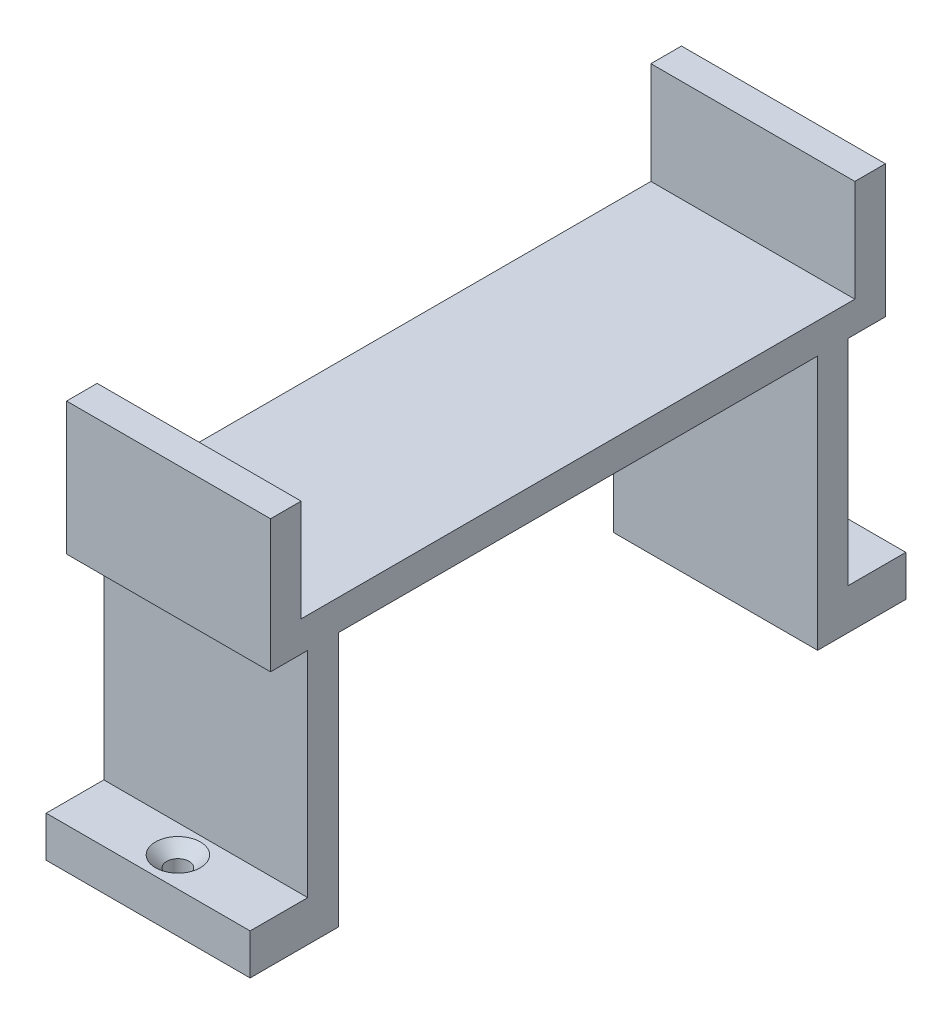
from build123d import *

# Parameters (mm, degrees)
SKETCH1_W                                           = 60.3
SKETCH1_H                                           = 38
BOSS_EXTRUDE1_DEPTH                                 = 10
SKETCH3_W                                           = 20
SKETCH3_H                                           = 54.3
CUT_EXTRUDE1_DEPTH                                  = 10
SKETCH4_W                                           = 20
SKETCH4_H                                           = 47
CUT_EXTRUDE2_DEPTH                                  = 25
SKETCH6_W                                           = 10
SKETCH6_H                                           = 21
CUT_EXTRUDE3_DEPTH                                  = 3.65
SKETCH7_W                                           = 10
SKETCH7_H                                           = 21
CUT_EXTRUDE4_DEPTH                                  = 3.65
MOVE_FACE1_BY                                       = 2
MOVE_FACE1_2_BY                                     = 2
MOVE_FACE2_BY                                       = 10
CSK_FOR_M2_COUNTERSUNK_FLAT_HEAD_SCREW2_D           = 2.2
CSK_FOR_M2_COUNTERSUNK_FLAT_HEAD_SCREW2_DEPTH       = 4
CSK_FOR_M2_COUNTERSUNK_FLAT_HEAD_SCREW2_CSINK_D     = 4.4
CSK_FOR_M2_COUNTERSUNK_FLAT_HEAD_SCREW2_CSINK_ANGLE = 90


with BuildPart() as part:
    # Sketch1 → Boss-Extrude1 (new body)
    with BuildSketch(Plane(origin=(0, 0, 0), x_dir=(0, 0, -1), z_dir=(1, 0, 0))):
        Rectangle(SKETCH1_W, SKETCH1_H)
    extrude(amount=BOSS_EXTRUDE1_DEPTH)

    # Sketch3 → Cut-Extrude1 (cut)
    with BuildSketch(Plane(origin=(0, 19, 0), x_dir=(1, 0, 0), z_dir=(0, 1, 0))):
        Rectangle(SKETCH3_W, SKETCH3_H)
    extrude(amount=-CUT_EXTRUDE1_DEPTH, mode=Mode.SUBTRACT)

    # Sketch4 → Cut-Extrude2 (cut)
    with BuildSketch(Plane.XZ.offset(19)):
        Rectangle(SKETCH4_W, SKETCH4_H)
    extrude(amount=-CUT_EXTRUDE2_DEPTH, mode=Mode.SUBTRACT)

    # Sketch6 → Cut-Extrude3 (cut)
    with BuildSketch(Plane(origin=(0, 0, -30.15), x_dir=(-1, 0, 0), z_dir=(0, 0, -1))):
        with Locations((-5, -4.5)):
            Rectangle(SKETCH6_W, SKETCH6_H)
    extrude(amount=-CUT_EXTRUDE3_DEPTH, mode=Mode.SUBTRACT)

    # Sketch7 → Cut-Extrude4 (cut)
    with BuildSketch(Plane.XY.offset(30.15)):
        with Locations((5, -4.5)):
            Rectangle(SKETCH7_W, SKETCH7_H)
    extrude(amount=-CUT_EXTRUDE4_DEPTH, mode=Mode.SUBTRACT)

    # Move Face1: a face moved outward by 2.0
    extrude(part.faces().sort_by_distance((5, -17, 30.15))[0], amount=MOVE_FACE1_BY, dir=(0, 0, 1))

    # Move Face1 2: a face moved outward by 2.0
    extrude(part.faces().sort_by_distance((5, -17, -30.15))[0], amount=MOVE_FACE1_2_BY, dir=(0, 0, -1))

    # Move Face2: a face moved outward by 10.0
    extrude(part.faces().sort_by_distance((0, 0, 25.72))[0], amount=MOVE_FACE2_BY, dir=(-1, 0, 0))

    # CSK for M2 Countersunk Flat Head Screw2
    with Locations(Plane(origin=(0, -15, 0), x_dir=(1, 0, 0), z_dir=(0, 1, 0))):
        with Locations((0, -29.232676383), (0, 29.454263306)):
            CounterSinkHole(CSK_FOR_M2_COUNTERSUNK_FLAT_HEAD_SCREW2_D / 2, CSK_FOR_M2_COUNTERSUNK_FLAT_HEAD_SCREW2_CSINK_D / 2, depth=CSK_FOR_M2_COUNTERSUNK_FLAT_HEAD_SCREW2_DEPTH, counter_sink_angle=CSK_FOR_M2_COUNTERSUNK_FLAT_HEAD_SCREW2_CSINK_ANGLE)


solid = part.part
